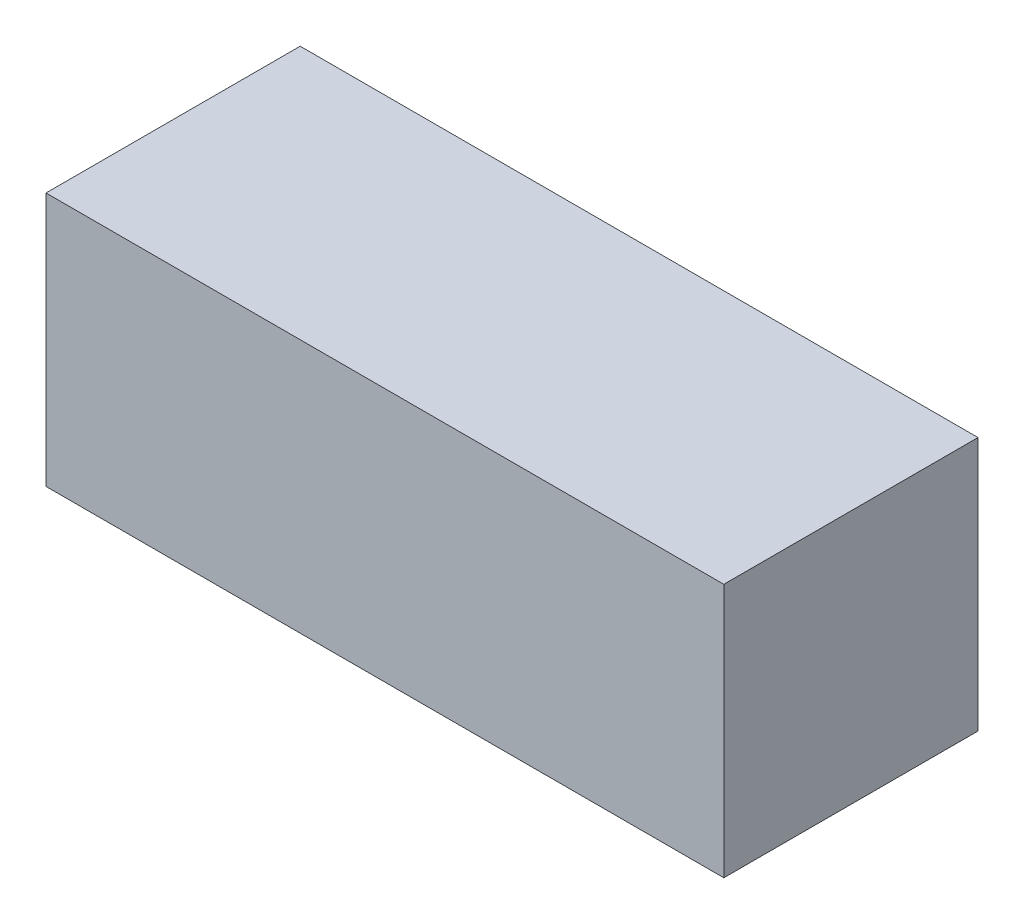
from build123d import *

# Parameters (mm, degrees)
SKETCH1_W           = 101.6
SKETCH1_H           = 38.1
BOSS_EXTRUDE1_DEPTH = 38.1


with BuildPart() as part:
    # Sketch1 → Boss-Extrude1 (new body)
    with BuildSketch(Plane.XY):
        Rectangle(SKETCH1_W, SKETCH1_H)
    extrude(amount=BOSS_EXTRUDE1_DEPTH)


solid = part.part
